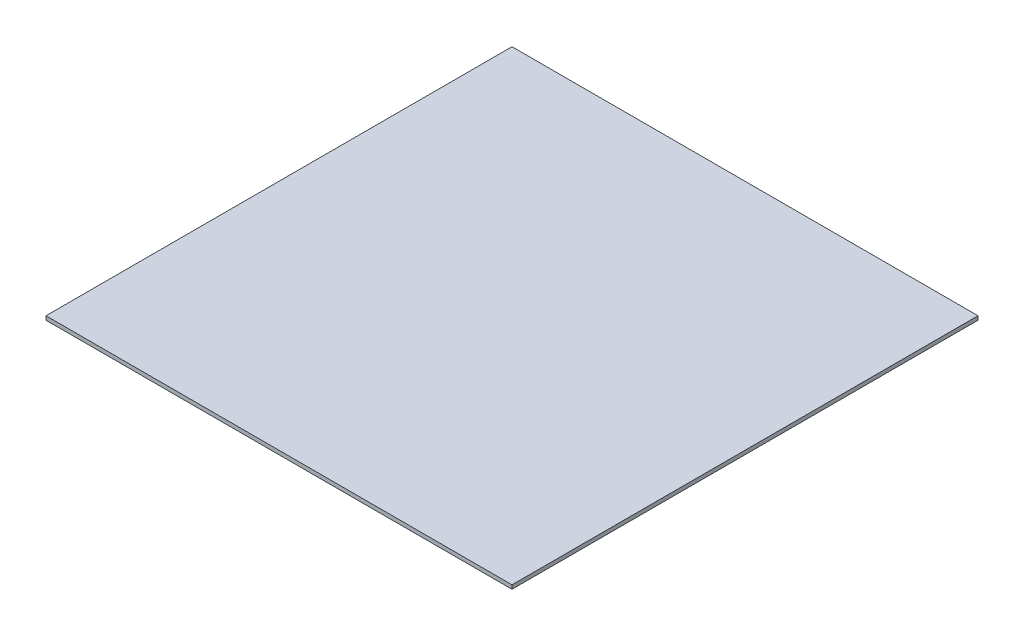
from build123d import *

# Parameters (mm, degrees)
CROQUIS1_W              = 120
CROQUIS1_H              = 120
SALIENTE_EXTRUIR1_DEPTH = 1


with BuildPart() as part:
    # Croquis1 → Saliente-Extruir1 (new body)
    with BuildSketch(Plane(origin=(0, 0, 0), x_dir=(1, 0, 0), z_dir=(0, 1, 0))):
        Rectangle(CROQUIS1_W, CROQUIS1_H)
    extrude(amount=SALIENTE_EXTRUIR1_DEPTH)


solid = part.part
